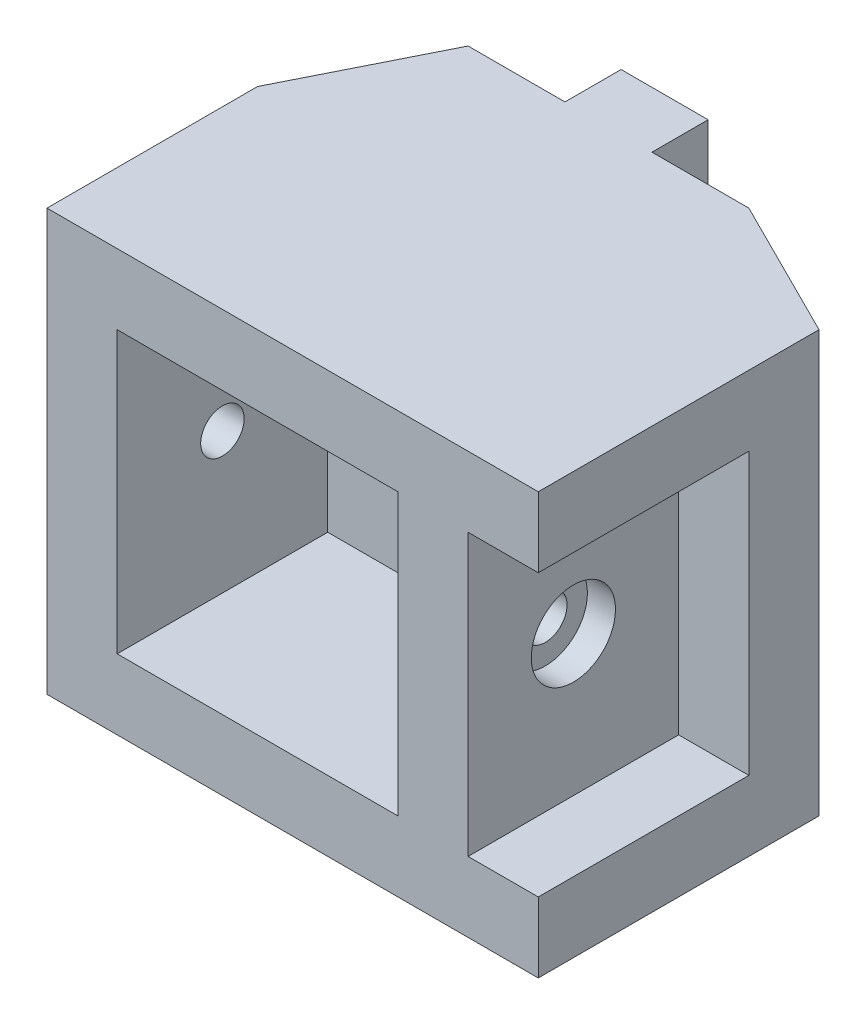
from build123d import *

# Parameters (mm, degrees)
EXTRUDE_1_DEPTH      = 14
CUT_EXTRUDE_1_DEPTH  = 44
SKETCH_3_W           = 6.2
SKETCH_3_H           = 6.2
CUT_EXTRUDE_2_DEPTH  = 4
SKETCH_4_R           = 4
CUT_EXTRUDE_3_DEPTH  = 5
SKETCH_5_R           = 2.6
CUT_EXTRUDE_4_DEPTH  = 5
EXTRUDE_2_DEPTH      = 44
SKETCH_8_W           = 5
SKETCH_8_H           = 5
EXTRUDE_4_DEPTH      = 15
SKETCH_9_W           = 35
SKETCH_9_H           = 5
EXTRUDE_5_DEPTH      = 7
CUT_EXTRUDE_6_DEPTH  = 10
CUT_EXTRUDE_START    = -30
SKETCH_14_R          = 1.55
CUT_EXTRUDE_7_DEPTH  = 30
SKETCH_15_R          = 3
CUT_EXTRUDE_8_DEPTH  = 2
CUT_EXTRUDE_START_2  = -2
SKETCH_16_R          = 3
CUT_EXTRUDE_9_DEPTH  = 2
SKETCH_17_W          = 35
SKETCH_17_H          = 7
CUT_EXTRUDE_10_DEPTH = 10
SKETCH_18_W          = 35
SKETCH_18_H          = 7
CUT_EXTRUDE_11_DEPTH = 20
SKETCH_19_R          = 5
CUT_EXTRUDE_12_DEPTH = 7


with BuildPart() as part:
    # 草图1 → 凸台-拉伸1 (new body)
    with BuildSketch(Plane.XY):
        Polygon((-15, 22), (-15, -22), (15, -22), (15, 22), (0, 22), align=None)
    extrude(amount=EXTRUDE_1_DEPTH)

    # 草图2 → 切除-拉伸1 (cut)
    with BuildSketch(Plane(origin=(0, 22, 0), x_dir=(1, 0, 0), z_dir=(0, 1, 0))):
        Polygon((-15, 0), (-15, -14), (-10, -4), (-3.1, -4), (-3.1, 0), align=None)
        Polygon((3.1, -4), (10, -4), (15, -14), (15, 0), (3.1, 0), align=None)
    extrude(amount=-CUT_EXTRUDE_1_DEPTH, mode=Mode.SUBTRACT)

    # 草图3 → 切除-拉伸2 (cut)
    with BuildSketch(Plane(origin=(0, 0, 0), x_dir=(-1, 0, 0), z_dir=(0, 0, -1))):
        Rectangle(SKETCH_3_W, SKETCH_3_H)
    extrude(amount=-CUT_EXTRUDE_2_DEPTH, mode=Mode.SUBTRACT)

    # 草图4 → 切除-拉伸3 (cut)
    with BuildSketch(Plane.XY.offset(14)):
        Circle(SKETCH_4_R)
    extrude(amount=-CUT_EXTRUDE_3_DEPTH, mode=Mode.SUBTRACT)

    # 草图5 → 切除-拉伸4 (cut)
    with BuildSketch(Plane.XY.offset(9)):
        Circle(SKETCH_5_R)
    extrude(amount=-CUT_EXTRUDE_4_DEPTH, mode=Mode.SUBTRACT)

    # 草图7 → 凸台-拉伸2 (add)
    with BuildSketch(Plane.XZ.offset(22)):
        Polygon((15, 14), (20, 14), (20, 9), (10, 4), (10, 14), align=None)
    extrude(amount=-EXTRUDE_2_DEPTH)

    # 草图8 → 凸台-拉伸4 (add)
    with BuildSketch(Plane.XY.offset(14)):
        with Locations((-12.5, -12.5)):
            Rectangle(SKETCH_8_W, SKETCH_8_H)
        Polygon((-10, -10), (-10, -15), (10, -15), (10, -10), (0, -10), align=None)
        Polygon((-10, 0), (-10, 10), (-15, 10), (-15, -10), (-10, -10), align=None)
        with Locations((-12.5, 12.5)):
            Rectangle(SKETCH_8_W, SKETCH_8_H)
        Polygon((-10, 15), (10, 15), (10, 10), (0, 10), (-10, 10), align=None)
        with Locations((12.5, 12.5)):
            Rectangle(SKETCH_8_W, SKETCH_8_H)
        Polygon((15, 10), (15, -10), (10, -10), (10, 0), (10, 10), align=None)
        with Locations((12.5, -12.5)):
            Rectangle(SKETCH_8_W, SKETCH_8_H)
        with Locations((17.5, -12.5)):
            Rectangle(SKETCH_8_W, SKETCH_8_H)
        with Locations((17.5, 12.5)):
            Rectangle(SKETCH_8_W, SKETCH_8_H)
    extrude(amount=EXTRUDE_4_DEPTH)

    # 草图9 → 凸台-拉伸5 (add)
    with BuildSketch(Plane(origin=(0, 15, 0), x_dir=(1, 0, 0), z_dir=(0, 1, 0))):
        with Locations((2.5, -26.5)):
            Rectangle(SKETCH_9_W, SKETCH_9_H)
    extrude(amount=EXTRUDE_5_DEPTH)

    # 草图13 → 切除-拉伸6 (cut)
    with BuildSketch(Plane(origin=(-10, 0, 0), x_dir=(0, 0, -1), z_dir=(1, 0, 0))):
        with BuildLine():
            ThreePointArc((-19.95, 0), (-20.806818927, 1.386362146), (-22.43, 1.24))
            Line((-22.43, 1.24), (-20.57, -1.24))
            ThreePointArc((-20.57, -1.24), (-20.113637854, -0.693181073), (-19.95, 0))
        make_face()
        with BuildLine():
            Line((-20.57, -1.24), (-22.43, 1.24))
            ThreePointArc((-22.43, 1.24), (-22.74, -0.93), (-20.57, -1.24))
        make_face()
    extrude(amount=-CUT_EXTRUDE_6_DEPTH, mode=Mode.SUBTRACT)

    # 草图14 → 切除-拉伸7 (cut)
    with BuildSketch(Plane.ZY.offset(15).offset(CUT_EXTRUDE_START)):
        with Locations(Location((21.5, 0, 0), (0, 0, 180))):
            Circle(SKETCH_14_R)
    extrude(amount=CUT_EXTRUDE_7_DEPTH, mode=Mode.SUBTRACT)

    # 草图15 → 切除-拉伸8 (cut)
    with BuildSketch(Plane(origin=(15, 0, 0), x_dir=(0, 0, -1), z_dir=(1, 0, 0))):
        with Locations((-21.5, 0)):
            Circle(SKETCH_15_R)
    extrude(amount=-CUT_EXTRUDE_8_DEPTH, mode=Mode.SUBTRACT)

    # 草图16 → 切除-拉伸9 (cut)
    with BuildSketch(Plane.ZY.offset(15).offset(CUT_EXTRUDE_START_2)):
        with Locations(Location((21.5, 0, 0), (0, 0, 180))):
            Circle(SKETCH_16_R)
    extrude(amount=CUT_EXTRUDE_9_DEPTH, mode=Mode.SUBTRACT)

    # 草图17 → 切除-拉伸10 (cut)
    with BuildSketch(Plane.XY.offset(29)):
        with Locations((2.5, 18.5)):
            Rectangle(SKETCH_17_W, SKETCH_17_H)
    extrude(amount=-CUT_EXTRUDE_10_DEPTH, mode=Mode.SUBTRACT)

    # 草图18 → 切除-拉伸11 (cut)
    with BuildSketch(Plane.XY.offset(14)):
        with Locations((2.5, 18.5)):
            Rectangle(SKETCH_18_W, SKETCH_18_H)
        with Locations((2.5, -18.5)):
            Rectangle(SKETCH_18_W, SKETCH_18_H)
    extrude(amount=-CUT_EXTRUDE_11_DEPTH, mode=Mode.SUBTRACT)

    # 草图19 → 切除-拉伸12 (cut)
    with BuildSketch(Plane.XY.offset(14)):
        Circle(SKETCH_19_R)
    extrude(amount=-CUT_EXTRUDE_12_DEPTH, mode=Mode.SUBTRACT)


solid = part.part
